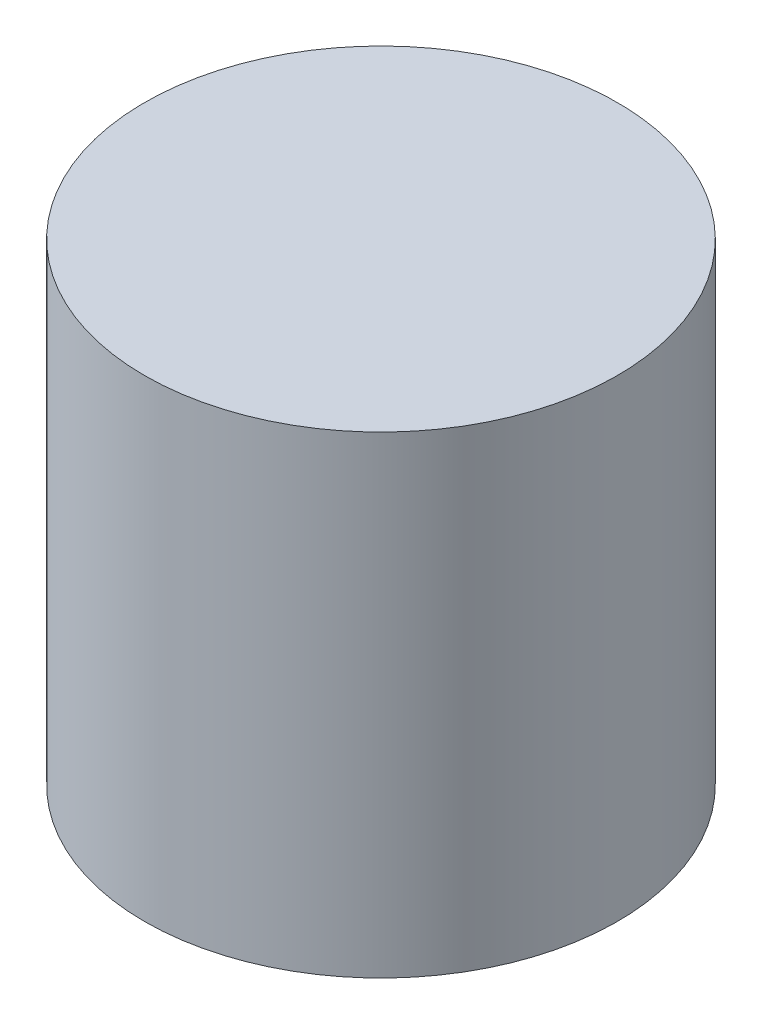
from build123d import *

# Parameters (mm, degrees)
SKETCH_1_R      = 7.5
EXTRUDE_1_DEPTH = 15


with BuildPart() as part:
    # 草圖1 → 填料-伸長1 (new body)
    with BuildSketch(Plane(origin=(0, 0, 0), x_dir=(1, 0, 0), z_dir=(0, 1, 0))):
        with Locations(Location((0, 0, 0), (0, 0, 270))):
            Circle(SKETCH_1_R)
    extrude(amount=EXTRUDE_1_DEPTH)


solid = part.part
